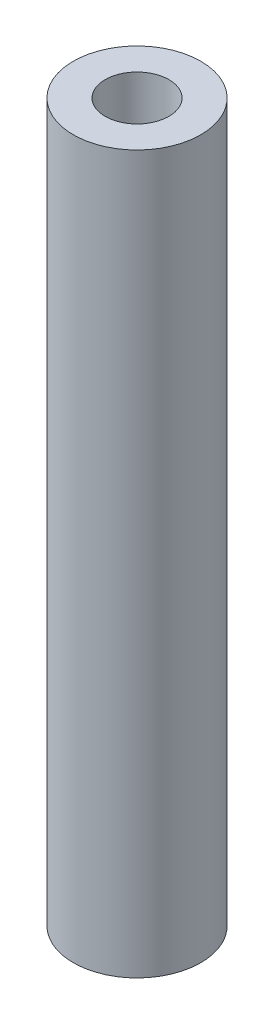
from build123d import *

# Parameters (mm, degrees)
SKETCH1_R           = 4
SKETCH1_R_2         = 2
BOSS_EXTRUDE1_DEPTH = 45


with BuildPart() as part:
    # Sketch1 → Boss-Extrude1 (new body)
    with BuildSketch(Plane(origin=(0, 0, 0), x_dir=(1, 0, 0), z_dir=(0, 1, 0))):
        with Locations(Location((0, 0, 0), (0, 0, 90))):
            Circle(SKETCH1_R)
        with Locations(Location((0, 0, 0), (0, 0, 90))):
            Circle(SKETCH1_R_2, mode=Mode.SUBTRACT)
    extrude(amount=BOSS_EXTRUDE1_DEPTH)


solid = part.part
